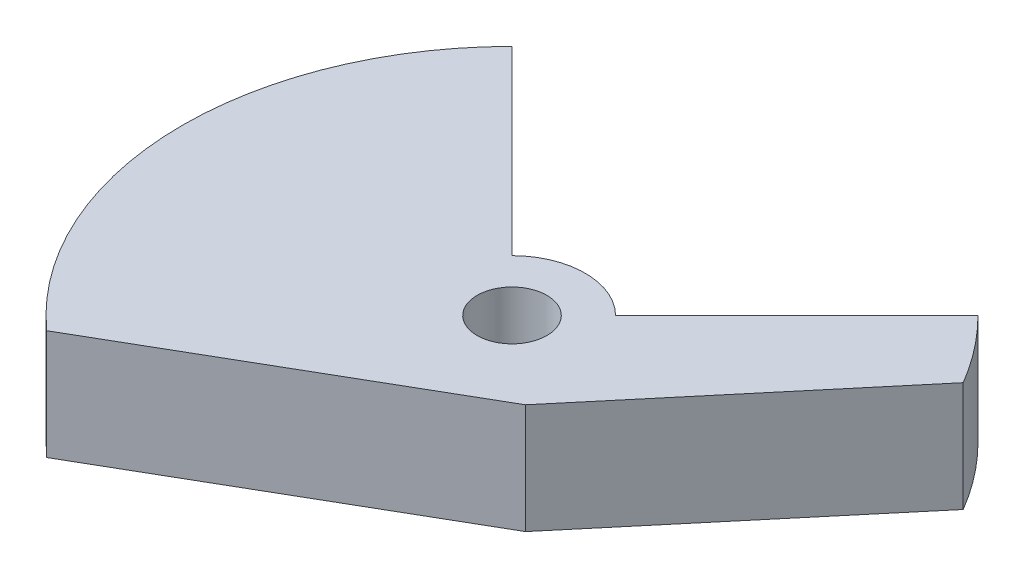
from build123d import *

# Parameters (mm, degrees)
SKETCH1_R           = 4.7625
BOSS_EXTRUDE1_DEPTH = 15
CUT_EXTRUDE1_DEPTH  = 66.383484153


with BuildPart() as part:
    # Sketch1 → Boss-Extrude1 (new body)
    with BuildSketch(Plane(origin=(0, 0, 0), x_dir=(1, 0, 0), z_dir=(0, 1, 0))):
        with BuildLine():
            Line((-31.819805153, 31.819805153), (-7.071067812, 7.071067812))
            ThreePointArc((-7.071067812, 7.071067812), (0, 10), (7.071067812, 7.071067812))
            Line((7.071067812, 7.071067812), (31.819805153, 31.819805153))
            ThreePointArc((31.819805153, 31.819805153), (0, -45), (-31.819805153, 31.819805153))
        make_face()
        with Locations(Location((0, 0, 0), (0, 0, 270))):
            Circle(SKETCH1_R, mode=Mode.SUBTRACT)
    extrude(amount=BOSS_EXTRUDE1_DEPTH)

    # Sketch4 → Cut-Extrude1 (cut, through all)
    with BuildSketch(Plane(origin=(0, 15, 0), x_dir=(1, 0, 0), z_dir=(0, 1, 0))):
        with BuildLine():
            Line((11.490666647, -9.641814145), (45.503789868, 30.893447649))
            ThreePointArc((45.503789868, 30.893447649), (34.992750198, -42.432386612), (-38.992939572, -38.788537785))
            Line((-38.992939572, -38.788537785), (11.490666647, -9.641814145))
        make_face()
    extrude(amount=-CUT_EXTRUDE1_DEPTH, mode=Mode.SUBTRACT)


solid = part.part
